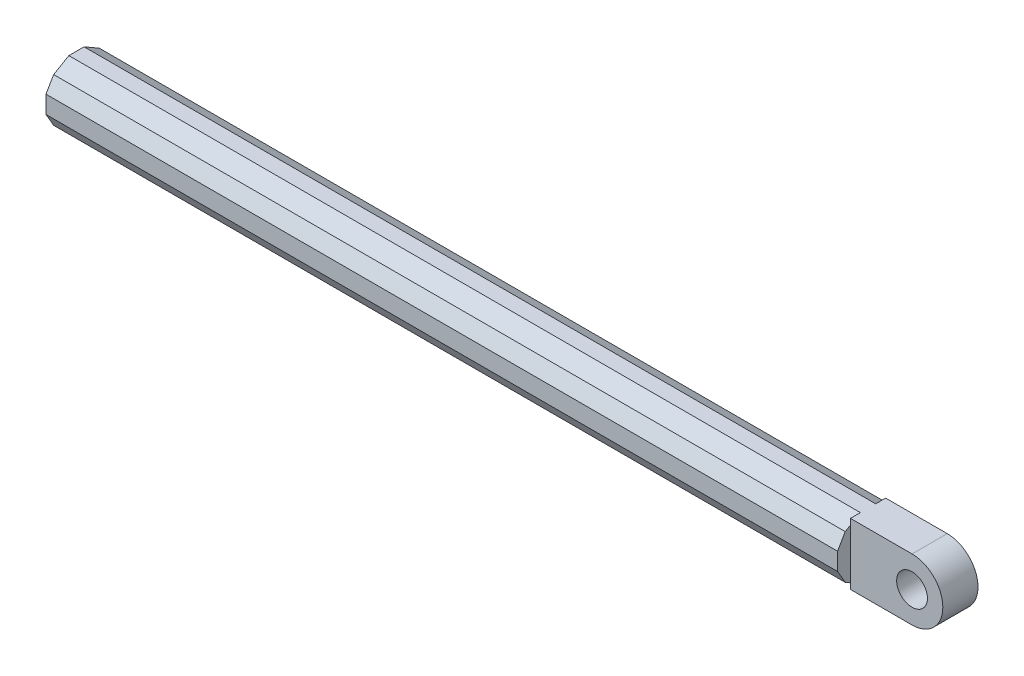
from build123d import *

# Parameters (mm, degrees)
BOSS_EXTRUDE1_DEPTH      = 90
CUT_EXTRUDE1_DEPTH       = 10
CHAMFER1_SIZE            = 1
CHAMFER1_EDGE_2_SIZE     = 1
CHAMFER1_EDGE_3_SIZE     = 1
CHAMFER1_EDGE_4_SIZE     = 1
CHAMFER1_EDGE_5_SIZE     = 1
CHAMFER1_EDGE_6_SIZE     = 1
BOSS_EXTRUDE2_DEPTH      = 2
BOSS_EXTRUDE2_DEPTH_BACK = 2
SKETCH2_R                = 1.75


with BuildPart() as part:
    # Sketch1 → Boss-Extrude1 (new body)
    with BuildSketch(Plane(origin=(0, 0, 0), x_dir=(0, 0, -1), z_dir=(1, 0, 0))):
        Polygon((3.464101615, -2), (3.464101615, 2), (0, 4), (-3.464101615, 2), (-3.464101615, -2), (0, -4), align=None)
    extrude(amount=BOSS_EXTRUDE1_DEPTH)

    # Sketch5 → Cut-Extrude1 (cut)
    with BuildSketch(Plane.ZY):
        with BuildLine():
            Line((1.404006351, -1.931810334), (2.375, -1.371206889))
            Line((2.375, -1.371206889), (2.375, -0.25))
            ThreePointArc((2.375, -0.25), (2.125, 0), (2.375, 0.25))
            Line((2.375, 0.25), (2.375, 1.371206889))
            Line((2.375, 1.371206889), (1.404006351, 1.931810334))
            ThreePointArc((1.404006351, 1.931810334), (1.0625, 1.840303983), (0.970993649, 2.181810334))
            Line((0.970993649, 2.181810334), (0, 2.742413779))
            Line((0, 2.742413779), (-0.970993649, 2.181810334))
            ThreePointArc((-0.970993649, 2.181810334), (-0.946018543, 2.121515095), (-0.9375, 2.056810334))
            ThreePointArc((-0.9375, 2.056810334), (-1.122795239, 1.815328877), (-1.404006351, 1.931810334))
            Line((-1.404006351, 1.931810334), (-2.375, 1.371206889))
            Line((-2.375, 1.371206889), (-2.375, 0.25))
            ThreePointArc((-2.375, 0.25), (-2.198223305, 0.176776695), (-2.125, 0))
            ThreePointArc((-2.125, 0), (-2.198223305, -0.176776695), (-2.375, -0.25))
            Line((-2.375, -0.25), (-2.375, -1.371206889))
            Line((-2.375, -1.371206889), (-1.404006351, -1.931810334))
            ThreePointArc((-1.404006351, -1.931810334), (-1.122795239, -1.815328877), (-0.9375, -2.056810334))
            ThreePointArc((-0.9375, -2.056810334), (-0.946018543, -2.121515095), (-0.970993649, -2.181810334))
            Line((-0.970993649, -2.181810334), (0, -2.742413779))
            Line((0, -2.742413779), (0.970993649, -2.181810334))
            ThreePointArc((0.970993649, -2.181810334), (1.0625, -1.840303983), (1.404006351, -1.931810334))
        make_face()
    extrude(amount=-CUT_EXTRUDE1_DEPTH, mode=Mode.SUBTRACT)

    # Chamfer1
    chamfer1_edges = [part.edges().sort_by_distance(p)[0] for p in [
        (45, -4, 0),
    ]]
    chamfer(chamfer1_edges, length=CHAMFER1_SIZE)

    # Chamfer1 edge 2
    chamfer1_edge_2_edges = [part.edges().sort_by_distance(p)[0] for p in [
        (45, -2, 3.464101615),
    ]]
    chamfer(chamfer1_edge_2_edges, length=CHAMFER1_EDGE_2_SIZE)

    # Chamfer1 edge 3
    chamfer1_edge_3_edges = [part.edges().sort_by_distance(p)[0] for p in [
        (45, 2, 3.464101615),
    ]]
    chamfer(chamfer1_edge_3_edges, length=CHAMFER1_EDGE_3_SIZE)

    # Chamfer1 edge 4
    chamfer1_edge_4_edges = [part.edges().sort_by_distance(p)[0] for p in [
        (45, 4, 0),
    ]]
    chamfer(chamfer1_edge_4_edges, length=CHAMFER1_EDGE_4_SIZE)

    # Chamfer1 edge 5
    chamfer1_edge_5_edges = [part.edges().sort_by_distance(p)[0] for p in [
        (45, 2, -3.464101615),
    ]]
    chamfer(chamfer1_edge_5_edges, length=CHAMFER1_EDGE_5_SIZE)

    # Chamfer1 edge 6
    chamfer1_edge_6_edges = [part.edges().sort_by_distance(p)[0] for p in [
        (45, -2, -3.464101615),
    ]]
    chamfer(chamfer1_edge_6_edges, length=CHAMFER1_EDGE_6_SIZE)

    # Sketch2 → Boss-Extrude2 (add, two sides: drawn at the far end of the back side and taken through both)
    with BuildSketch(Plane.XY.offset(-BOSS_EXTRUDE2_DEPTH_BACK)):
        with BuildLine():
            Line((90, 3.5), (97, 3.5))
            ThreePointArc((97, 3.5), (100.5, 0), (97, -3.5))
            Line((97, -3.5), (90, -3.5))
            Line((90, -3.5), (90, 3.5))
        make_face()
        with Locations((97, 0)):
            Circle(SKETCH2_R, mode=Mode.SUBTRACT)
    extrude(amount=BOSS_EXTRUDE2_DEPTH + BOSS_EXTRUDE2_DEPTH_BACK)


solid = part.part
